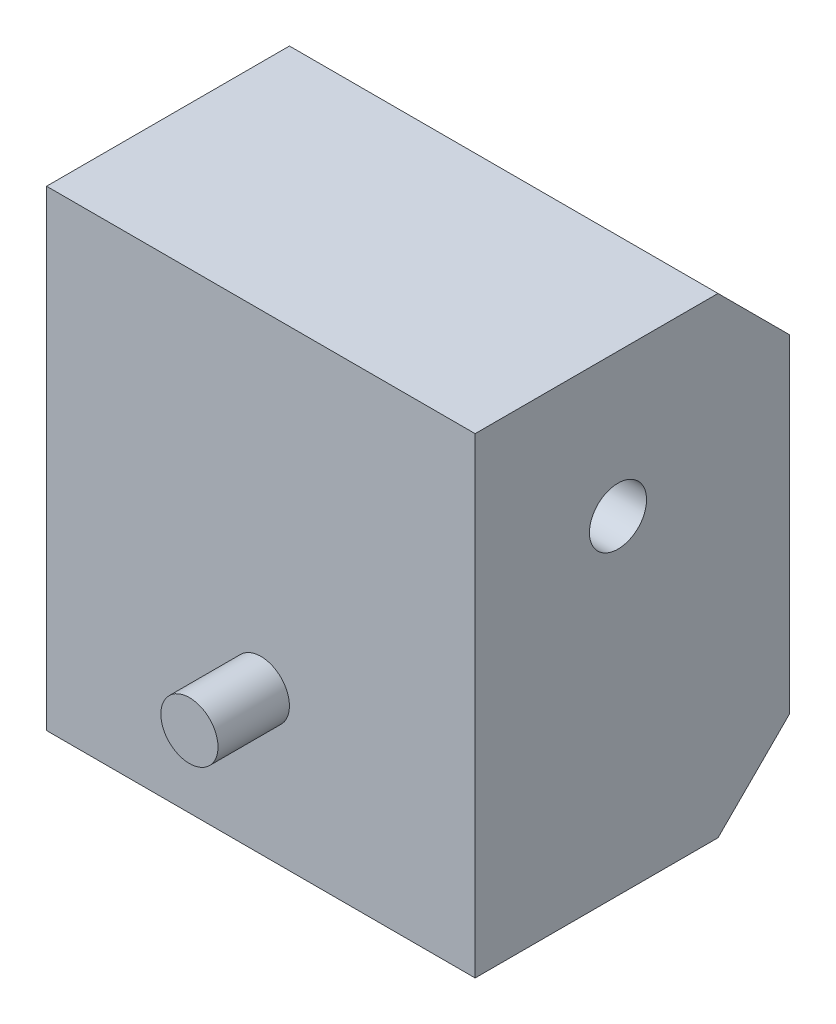
from build123d import *

# Parameters (mm, degrees)
CROQUIS1_W              = 30
CROQUIS1_H              = 33
SALIENTE_EXTRUIR1_DEPTH = 22
CHAFL_N1_SIZE           = 5
CHAFL_N2_SIZE           = 5
CROQUIS3_R              = 2
CORTAR_EXTRUIR1_DEPTH   = 35
CROQUIS2_R              = 2
SALIENTE_EXTRUIR2_DEPTH = 5


with BuildPart() as part:
    # Croquis1 → Saliente-Extruir1 (new body)
    with BuildSketch(Plane.XY):
        with Locations((-0.166051661, -4.433579336)):
            Rectangle(CROQUIS1_W, CROQUIS1_H)
    extrude(amount=SALIENTE_EXTRUIR1_DEPTH)

    # Chaflán1
    chafl_n1_edges = [part.edges().sort_by_distance(p)[0] for p in [
        (-0.166051661, 12.066420664, 0),
    ]]
    chamfer(chafl_n1_edges, length=CHAFL_N1_SIZE)

    # Chaflán2
    chafl_n2_edges = [part.edges().sort_by_distance(p)[0] for p in [
        (-0.166051661, -20.933579336, 0),
    ]]
    chamfer(chafl_n2_edges, length=CHAFL_N2_SIZE)

    # Croquis3 → Cortar-Extruir1 (cut)
    with BuildSketch(Plane(origin=(14.833948339, 0, 0), x_dir=(0, 0, -1), z_dir=(1, 0, 0))):
        with Locations(Location((-12, 2.066420664, 0), (0, 0, 90))):
            Circle(CROQUIS3_R)
    extrude(amount=-CORTAR_EXTRUIR1_DEPTH, mode=Mode.SUBTRACT)

    # Croquis2 → Saliente-Extruir2 (add)
    with BuildSketch(Plane.XY.offset(22)):
        with Locations((-0.166051661, -10.933579336)):
            Circle(CROQUIS2_R)
    extrude(amount=SALIENTE_EXTRUIR2_DEPTH)


solid = part.part
